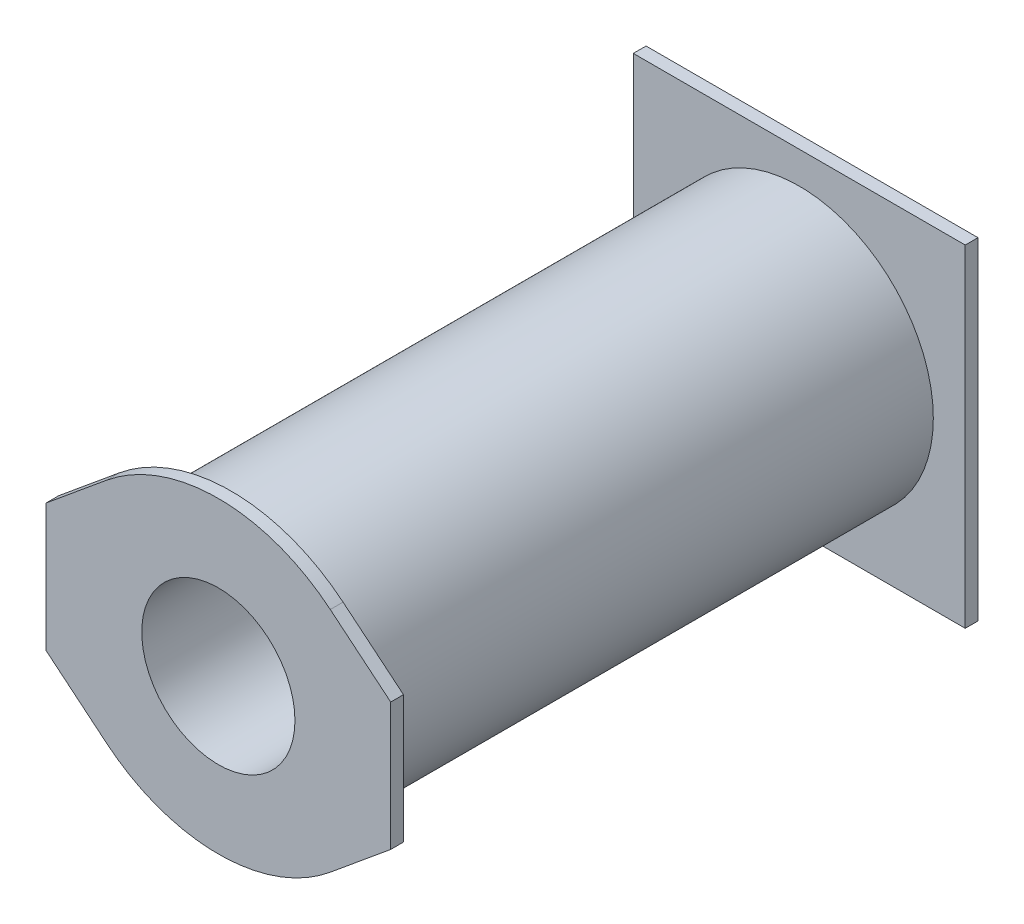
from build123d import *

# Parameters (mm, degrees)
CROQUIS1_W              = 26
CROQUIS1_H              = 26
SALIENTE_EXTRUIR1_DEPTH = 1
CROQUIS2_R              = 10.5
SALIENTE_EXTRUIR2_DEPTH = 44.5
SALIENTE_EXTRUIR3_DEPTH = 1
CROQUIS4_R              = 6
CORTAR_EXTRUIR1_DEPTH   = 51.13481824


with BuildPart() as part:
    # Croquis1 → Saliente-Extruir1 (new body)
    with BuildSketch(Plane.XY):
        Rectangle(CROQUIS1_W, CROQUIS1_H)
    extrude(amount=SALIENTE_EXTRUIR1_DEPTH)

    # Croquis2 → Saliente-Extruir2 (add)
    with BuildSketch(Plane.XY.offset(1)):
        Circle(CROQUIS2_R)
    extrude(amount=SALIENTE_EXTRUIR2_DEPTH)

    # Croquis3 → Saliente-Extruir3 (add)
    with BuildSketch(Plane.XY.offset(45.5)):
        with BuildLine():
            ThreePointArc((10.5, 0), (0, -10.5), (-10.5, 0))
            Line((-10.5, 0), (-13.5, 0))
            Line((-13.5, 0), (-13.5, -5))
            Line((-13.5, -5), (-8.766919396, -8.910169713))
            ThreePointArc((-8.766919396, -8.910169713), (0, -12.063114964), (8.766919396, -8.910169713))
            Line((8.766919396, -8.910169713), (13.5, -5))
            Line((13.5, -5), (13.5, 0))
            Line((13.5, 0), (10.5, 0))
        make_face()
        with BuildLine():
            Line((-13.5, 0), (-10.5, 0))
            ThreePointArc((-10.5, 0), (0, 10.5), (10.5, 0))
            Line((10.5, 0), (13.5, 0))
            Line((13.5, 0), (13.5, 5))
            Line((13.5, 5), (8.766919396, 8.910169713))
            ThreePointArc((8.766919396, 8.910169713), (0, 12.063114964), (-8.766919396, 8.910169713))
            Line((-8.766919396, 8.910169713), (-13.5, 5))
            Line((-13.5, 5), (-13.5, 0))
        make_face()
        with BuildLine():
            Line((10.5, 0), (0, 0))
            Line((0, 0), (-10.5, 0))
            ThreePointArc((-10.5, 0), (0, -10.5), (10.5, 0))
        make_face()
        with BuildLine():
            Line((-10.5, 0), (0, 0))
            Line((0, 0), (10.5, 0))
            ThreePointArc((10.5, 0), (0, 10.5), (-10.5, 0))
        make_face()
    extrude(amount=SALIENTE_EXTRUIR3_DEPTH)

    # Croquis4 → Cortar-Extruir1 (cut, through all)
    with BuildSketch(Plane.XY.offset(46.5)):
        Circle(CROQUIS4_R)
    extrude(amount=-CORTAR_EXTRUIR1_DEPTH, mode=Mode.SUBTRACT)


solid = part.part
